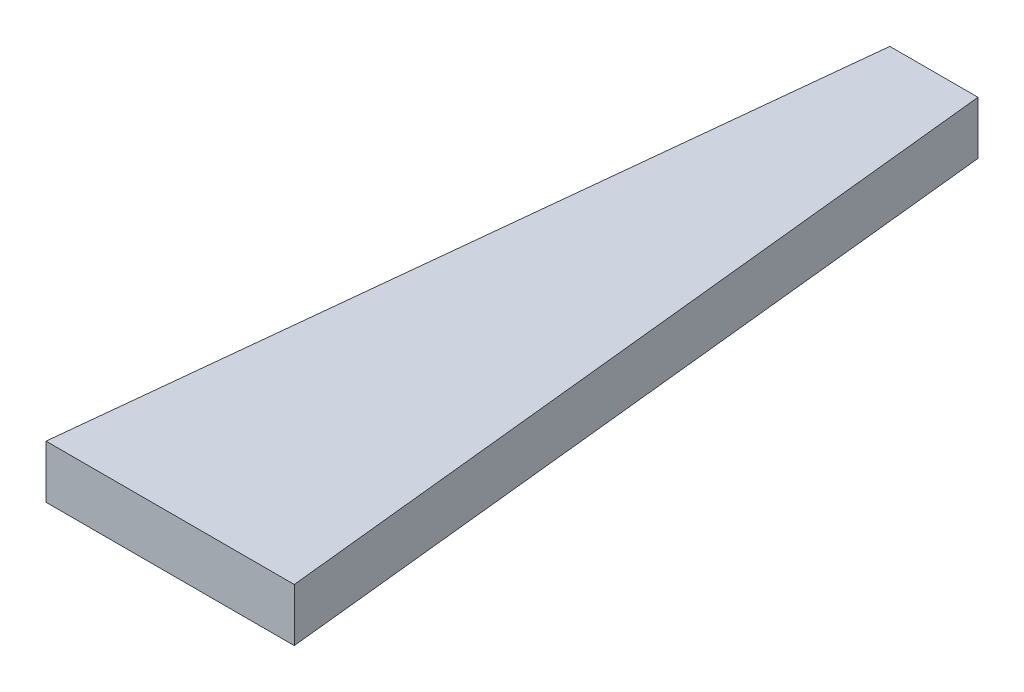
from build123d import *

# Parameters (mm, degrees)
BOSS_EXTRUDE1_DEPTH = 6.35


with BuildPart() as part:
    # Sketch1 → Boss-Extrude1 (new body)
    with BuildSketch(Plane(origin=(0, 0, 0), x_dir=(1, 0, 0), z_dir=(0, 1, 0))):
        Polygon((0, 0), (9.599736823, 91.581347925), (20.16961034, 91.581347925), (29.769347162, 0), align=None)
    extrude(amount=BOSS_EXTRUDE1_DEPTH)


solid = part.part
